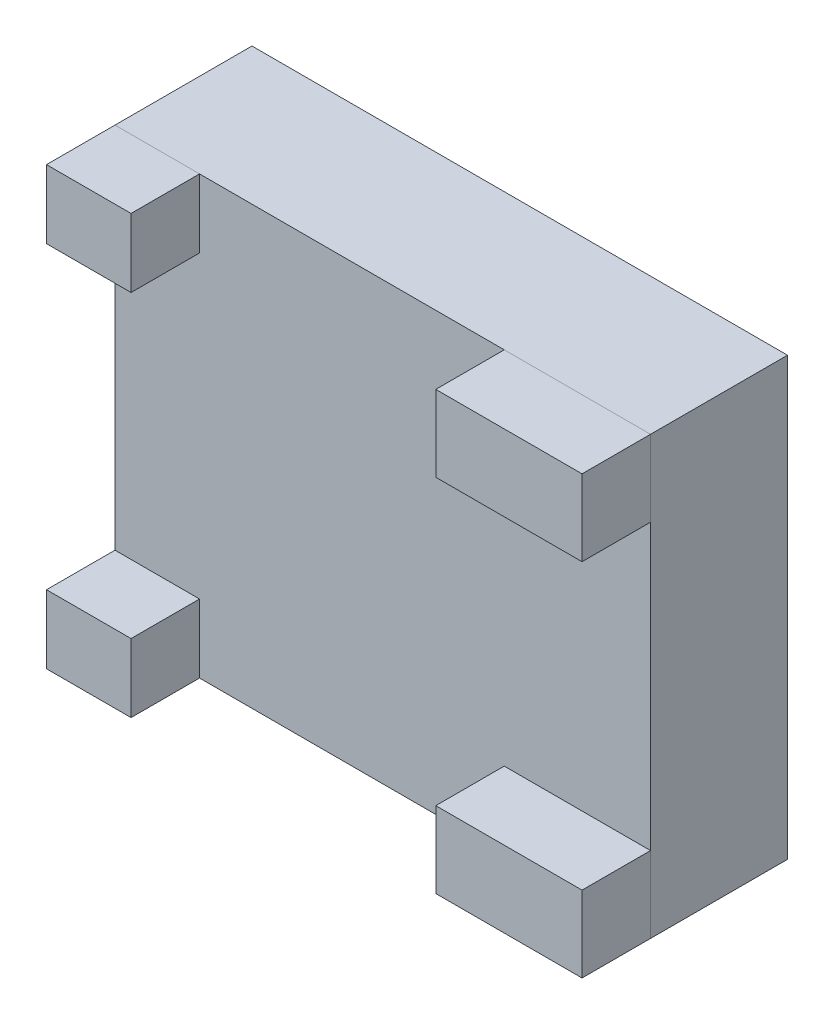
from build123d import *

# Parameters (mm, degrees)
ESBO_O1_W                  = 156.39786889
ESBO_O1_H                  = 127.51
NOVO_DEPTH                 = 40
ESBO_O2_W                  = 24.691065998
ESBO_O2_H                  = 20
RESSALTO_EXTRUS_O2_DEPTH   = 20
RESSALTO_EXTRUS_O2_2_DEPTH = 20
ESBO_O2_W_2                = 42.720162864
ESBO_O2_H_2                = 22.228889681
RESSALTO_EXTRUS_O2_3_DEPTH = 20
RESSALTO_EXTRUS_O2_4_DEPTH = 20


with BuildPart() as part:
    # Esboço1 → Novo (new body)
    with BuildSketch(Plane.XY):
        Rectangle(ESBO_O1_W, ESBO_O1_H)
    extrude(amount=NOVO_DEPTH)


with BuildPart() as body_2:
    # Esboço2 → Ressalto-extrusão2 (new body)
    with BuildSketch(Plane.XY.offset(40)):
        with Locations((-65.853401446, -53.755)):
            Rectangle(ESBO_O2_W, ESBO_O2_H)
    extrude(amount=RESSALTO_EXTRUS_O2_DEPTH)


with BuildPart() as body_3:
    # Esboço2 → Ressalto-extrus_o2 2 (new body)
    with BuildSketch(Plane.XY.offset(40)):
        with Locations((-65.853401446, 53.755)):
            Rectangle(ESBO_O2_W, ESBO_O2_H)
    extrude(amount=RESSALTO_EXTRUS_O2_2_DEPTH)


with BuildPart() as body_4:
    # Esboço2 → Ressalto-extrus_o2 3 (new body)
    with BuildSketch(Plane.XY.offset(40)):
        with Locations((56.838853013, 52.64055516)):
            Rectangle(ESBO_O2_W_2, ESBO_O2_H_2)
    extrude(amount=RESSALTO_EXTRUS_O2_3_DEPTH)


with BuildPart() as body_5:
    # Esboço2 → Ressalto-extrus_o2 4 (new body)
    with BuildSketch(Plane.XY.offset(40)):
        with Locations((56.838853013, -52.64055516)):
            Rectangle(ESBO_O2_W_2, ESBO_O2_H_2)
    extrude(amount=RESSALTO_EXTRUS_O2_4_DEPTH)


solid = Compound([part.part, body_2.part, body_3.part, body_4.part, body_5.part])
